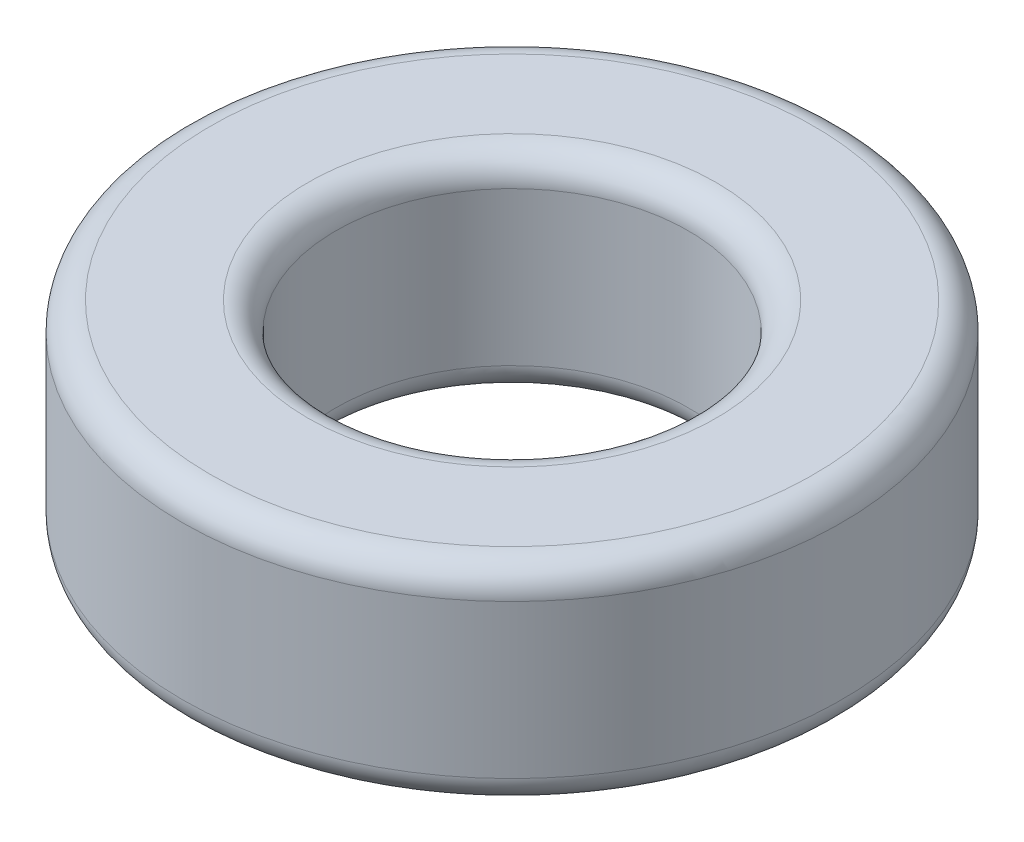
from build123d import *

# Parameters (mm, degrees)
SKETCH1_R           = 23.65
SKETCH1_R_2         = 12.65
BOSS_EXTRUDE1_DEPTH = 15
FILLET1_R           = 2


with BuildPart() as part:
    # Sketch1 → Boss-Extrude1 (new body)
    with BuildSketch(Plane(origin=(0, 0, 0), x_dir=(1, 0, 0), z_dir=(0, 1, 0))):
        with Locations(Location((0, 0, 0), (0, 0, 270))):
            Circle(SKETCH1_R)
        with Locations(Location((0, 0, 0), (0, 0, 270))):
            Circle(SKETCH1_R_2, mode=Mode.SUBTRACT)
    extrude(amount=BOSS_EXTRUDE1_DEPTH)

    # Fillet1
    fillet1_edges = [part.edges().sort_by_distance(p)[0] for p in [
        (0, 0, -23.65),
        (0, 15, -23.65),
        (0, 0, -12.65),
        (0, 15, -12.65),
    ]]
    fillet(fillet1_edges, radius=FILLET1_R)


solid = part.part
